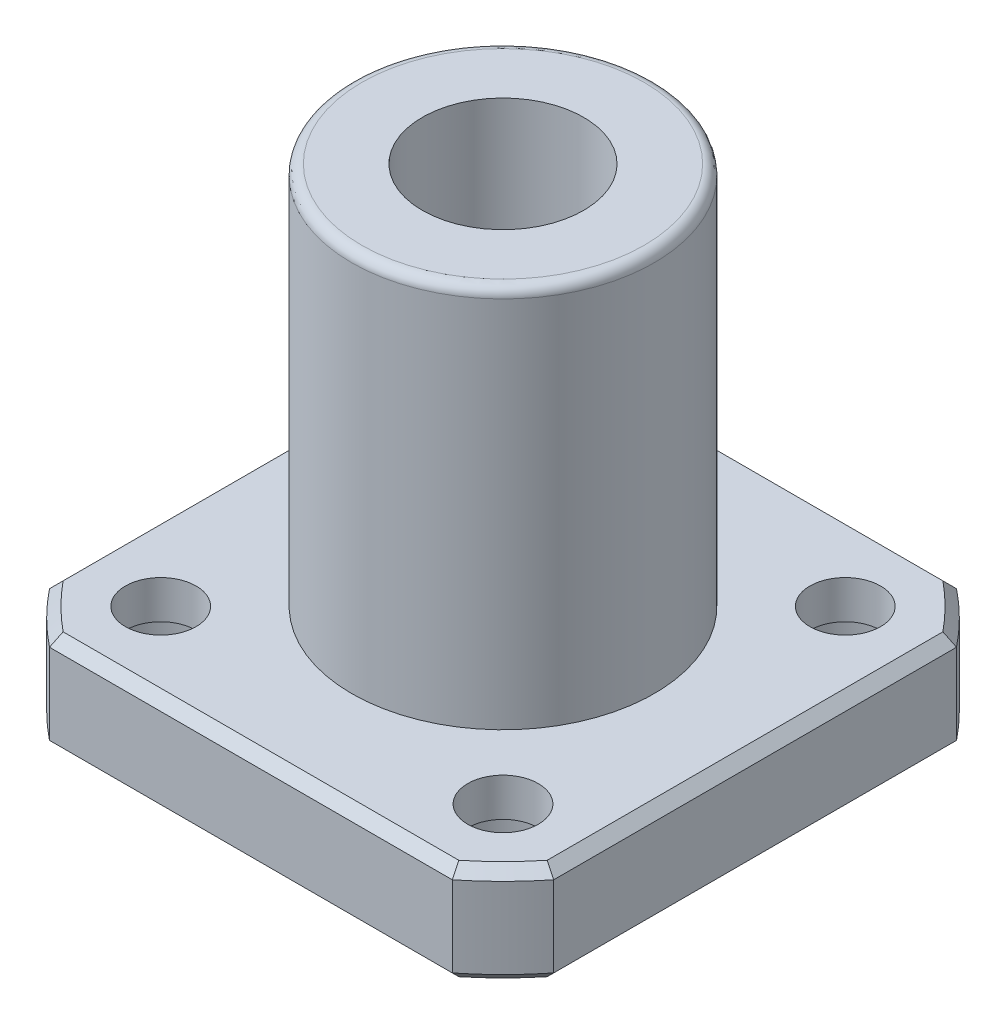
from build123d import *

# Parameters (mm, degrees)
SKETCH_1_R          = 1.75
SKETCH_1_R_2        = 7.5
EXTRUDE_1_DEPTH     = 5
SKETCH_1_3_R        = 7.5
SKETCH_1_3_R_2      = 4
EXTRUDE_2_DEPTH     = 24
SKETCH_2_R          = 3
CUT_EXTRUDE_1_DEPTH = 3.1
CHAMFER_1_SIZE      = 0.5
CHAMFER_2_SIZE      = 0.5
FILLET_1_R          = 0.5


with BuildPart() as part:
    # 草图1 → 凸台-拉伸1 (new body)
    with BuildSketch(Plane(origin=(0, 0, 0), x_dir=(1, 0, 0), z_dir=(0, 1, 0))):
        with BuildLine():
            ThreePointArc((-12.5, -9.987492178), (-11.313708499, -11.313708499), (-9.987492178, -12.5))
            Line((-9.987492178, -12.5), (9.987492178, -12.5))
            ThreePointArc((9.987492178, -12.5), (11.313708499, -11.313708499), (12.5, -9.987492178))
            Line((12.5, -9.987492178), (12.5, 9.987492178))
            ThreePointArc((12.5, 9.987492178), (11.313708499, 11.313708499), (9.987492178, 12.5))
            Line((9.987492178, 12.5), (-9.987492178, 12.5))
            ThreePointArc((-9.987492178, 12.5), (-11.313708499, 11.313708499), (-12.5, 9.987492178))
            Line((-12.5, 9.987492178), (-12.5, -9.987492178))
        make_face()
        with Locations(Location((-8.485281374, -8.485281374, 0), (0, 0, 270))):
            Circle(SKETCH_1_R, mode=Mode.SUBTRACT)
        with Locations(Location((8.485281374, -8.485281374, 0), (0, 0, 270))):
            Circle(SKETCH_1_R, mode=Mode.SUBTRACT)
        with Locations(Location((-8.485281374, 8.485281374, 0), (0, 0, 270))):
            Circle(SKETCH_1_R, mode=Mode.SUBTRACT)
        with Locations(Location((0, 0, 0), (0, 0, 270))):
            Circle(SKETCH_1_R_2, mode=Mode.SUBTRACT)
        with Locations(Location((8.485281374, 8.485281374, 0), (0, 0, 270))):
            Circle(SKETCH_1_R, mode=Mode.SUBTRACT)
    extrude(amount=EXTRUDE_1_DEPTH)

    # 草图1<3> → 凸台-拉伸2 (add)
    with BuildSketch(Plane(origin=(0, 0, 0), x_dir=(1, 0, 0), z_dir=(0, 1, 0))):
        with Locations(Location((0, 0, 0), (0, 0, 270))):
            Circle(SKETCH_1_3_R)
        with Locations(Location((0, 0, 0), (0, 0, 270))):
            Circle(SKETCH_1_3_R_2, mode=Mode.SUBTRACT)
    extrude(amount=EXTRUDE_2_DEPTH)

    # 草图2 → 切除-拉伸1 (cut)
    with BuildSketch(Plane.XZ):
        with Locations(Location((-8.485281374, 8.485281374, 0), (0, 0, 270))):
            Circle(SKETCH_2_R)
        with Locations(Location((8.485281374, 8.485281374, 0), (0, 0, 270))):
            Circle(SKETCH_2_R)
        with Locations(Location((8.485281374, -8.485281374, 0), (0, 0, 270))):
            Circle(SKETCH_2_R)
        with Locations(Location((-8.485281374, -8.485281374, 0), (0, 0, 270))):
            Circle(SKETCH_2_R)
    extrude(amount=-CUT_EXTRUDE_1_DEPTH, mode=Mode.SUBTRACT)

    # 倒角1
    chamfer_1_edges = [part.edges().sort_by_distance(p)[0] for p in [
        (0, 5, 12.5),
        (11.313708499, 5, 11.313708499),
        (12.5, 5, 0),
        (11.313708499, 5, -11.313708499),
        (0, 5, -12.5),
        (-11.313708499, 5, -11.313708499),
        (-12.5, 5, 0),
        (-11.313708499, 5, 11.313708499),
    ]]
    chamfer(chamfer_1_edges, length=CHAMFER_1_SIZE)

    # 倒角2
    chamfer_2_edges = [part.edges().sort_by_distance(p)[0] for p in [
        (-11.313708499, 0, 11.313708499),
        (-12.5, 0, 0),
        (-11.313708499, 0, -11.313708499),
        (0, 0, -12.5),
        (11.313708499, 0, -11.313708499),
        (12.5, 0, 0),
        (11.313708499, 0, 11.313708499),
        (0, 0, 12.5),
    ]]
    chamfer(chamfer_2_edges, length=CHAMFER_2_SIZE)

    # 圆角1
    fillet_1_edges = [part.edges().sort_by_distance(p)[0] for p in [
        (0, 24, -7.5),
    ]]
    fillet(fillet_1_edges, radius=FILLET_1_R)


solid = part.part
